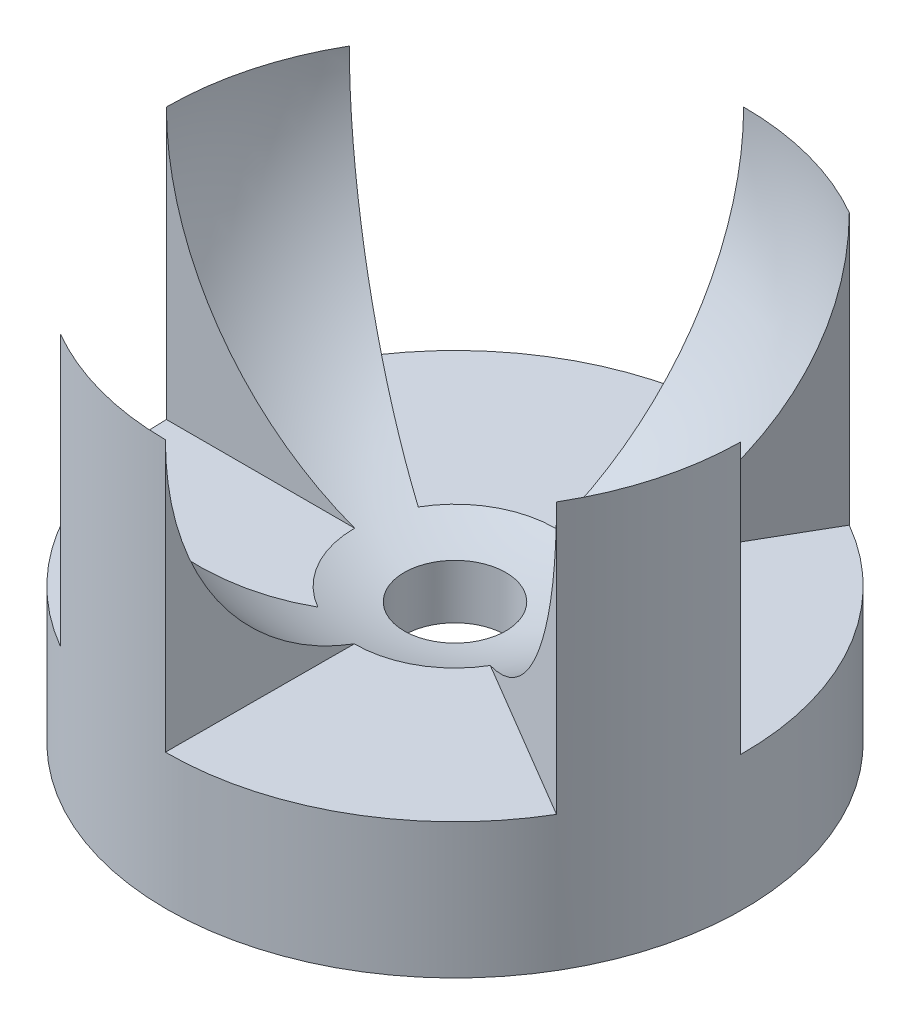
from build123d import *
from build123d.topology import SkipClean

# Parameters (mm, degrees)
SKETCH1_R           = 85.32472163
BOSS_EXTRUDE1_DEPTH = 40
BOSS_EXTRUDE6_DEPTH = 80
SKETCH7_R           = 50
CUT_EXTRUDE1_DEPTH  = 20
SKETCH8_R           = 15
CUT_EXTRUDE2_DEPTH  = 60


with BuildPart() as part:
    # Sketch1 → Boss-Extrude1 (new body)
    with BuildSketch(Plane(origin=(0, 0, 0), x_dir=(1, 0, 0), z_dir=(0, 1, 0))):
        with Locations(Location((0, 0, 0), (0, 0, 270))):
            Circle(SKETCH1_R)
    extrude(amount=BOSS_EXTRUDE1_DEPTH)

    # Sketch2 → Boss-Extrude6 (add)
    with SkipClean():  # the faces are left unmerged after this step: merging them gives an invalid solid
        with BuildSketch(Plane(origin=(0, 40, 0), x_dir=(1, 0, 0), z_dir=(0, 1, 0))):
            with BuildLine():
                Line((8.607565416, -5.090168722), (73.443812301, -43.431722922))
                ThreePointArc((73.443812301, -43.431722922), (82.182232136, -22.943165483), (85.320068664, -0.89106923))
                Line((85.320068664, -0.89106923), (10, 0))
                ThreePointArc((10, 0), (9.645611804, -2.638592981), (8.607565416, -5.090168722))
            make_face()
            with BuildLine():
                Line((-5.02968533, -8.643047234), (-42.915650066, -73.746559925))
                ThreePointArc((-42.915650066, -73.746559925), (-22.366320531, -82.341094401), (-0.292763215, -85.324219369))
                Line((-0.292763215, -85.324219369), (-0.034311652, -9.999941135))
                ThreePointArc((-0.034311652, -9.999941135), (-2.621317726, -9.650320895), (-5.02968533, -8.643047234))
            make_face()
            with BuildLine():
                Line((-10, 0), (-85.32472163, 0))
                ThreePointArc((-85.32472163, 0), (-82.417352244, 22.083662976), (-73.893376503, 42.662360815))
                Line((-73.893376503, 42.662360815), (-8.660254038, 5))
                ThreePointArc((-8.660254038, 5), (-9.659258263, 2.588190451), (-10, 0))
            make_face()
            with BuildLine():
                Line((0, 10), (0, 85.32472163))
                ThreePointArc((0, 85.32472163), (22.083662976, 82.417352244), (42.662360815, 73.893376503))
                Line((42.662360815, 73.893376503), (5, 8.660254038))
                ThreePointArc((5, 8.660254038), (2.588190451, 9.659258263), (0, 10))
            make_face()
        extrude(amount=BOSS_EXTRUDE6_DEPTH)

    # Sketch6 → Cut-Revolve1 (revolve, cut)
    with SkipClean():  # the faces are left unmerged after this step: merging them gives an invalid solid
        with BuildSketch(Plane(origin=(0, 0, 0), x_dir=(0.5000000000000012, 0, -0.866025403784438), z_dir=(0.8660254037844379, 0, 0.5000000000000011)), mode=Mode.PRIVATE) as cut_revolve1_sk:
            with BuildLine():
                Line((85.32472163, 120), (0, 120))
                Line((0, 120), (0, 34.67527837))
                ThreePointArc((0, 34.67527837), (60.333689268, 59.666310732), (85.32472163, 120))
            make_face()
        revolve(cut_revolve1_sk.sketch.rotate(Axis((0, 120, 0), (0, -1, 0)), 330), axis=Axis((0, 120, 0), (0, -1, 0)), mode=Mode.SUBTRACT)

    # Sketch7 → Cut-Extrude1 (cut)
    with SkipClean():  # the faces are left unmerged after this step: merging them gives an invalid solid
        with BuildSketch(Plane.XZ):
            with Locations(Location((0, 0, 0), (0, 0, 270))):
                Circle(SKETCH7_R)
        extrude(amount=-CUT_EXTRUDE1_DEPTH, mode=Mode.SUBTRACT)

    # Sketch8 → Cut-Extrude2 (cut)
    with SkipClean():  # the faces are left unmerged after this step: merging them gives an invalid solid
        with BuildSketch(Plane.XZ.offset(-20)):
            with Locations(Location((0, 0, 0), (0, 0, 270))):
                Circle(SKETCH8_R)
        extrude(amount=-CUT_EXTRUDE2_DEPTH, mode=Mode.SUBTRACT)


solid = part.part
